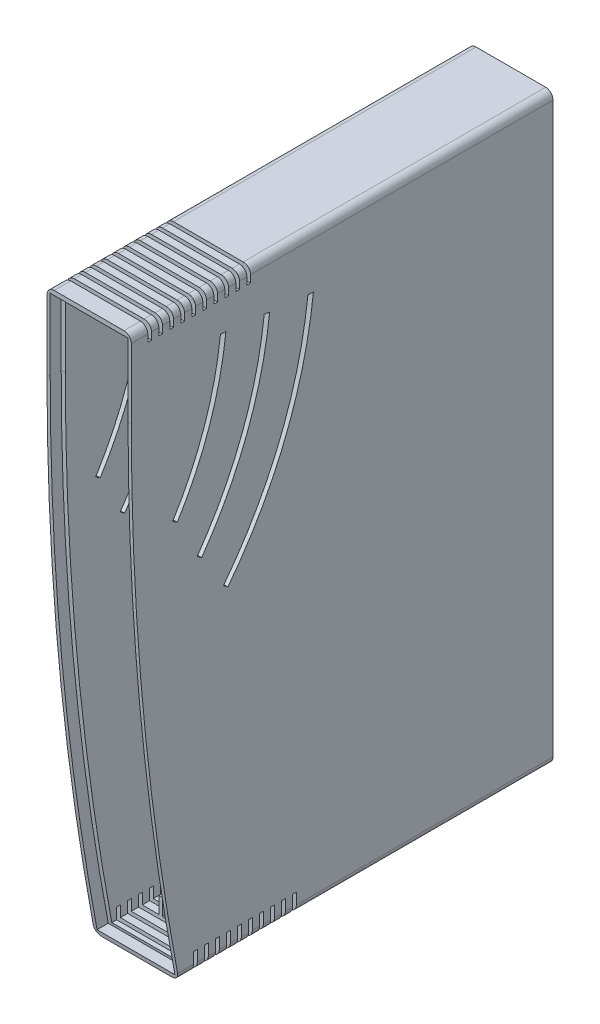
from build123d import *

# Parameters (mm, degrees)
SKETCH1_W               = 23
SKETCH1_H               = 159.1
BOSS_EXTRUDE1_DEPTH     = 115
SHELL1_T                = -2
CUT_EXTRUDE1_DEPTH      = 142.711687944
CUT_EXTRUDE1_DEPTH_BACK = 142.711687944
FILLET1_R               = 2
SKETCH3_W               = 25
SKETCH3_H               = 1
CUT_EXTRUDE2_DEPTH      = 4
LPATTERN1_COUNT         = 10
LPATTERN1_PITCH         = 3
SKETCH8_W               = 27.700077209
SKETCH8_H               = 1
CUT_EXTRUDE4_DEPTH      = 5
LPATTERN2_COUNT         = 10
LPATTERN2_PITCH         = 3
CUT_EXTRUDE3_DEPTH      = 142.711688098
SKETCH7_W               = 1
SKETCH7_H               = 4.5
BOSS_EXTRUDE3_DEPTH     = 90
CHAMFER2_SIZE           = 0.5
CUT_EXTRUDE6_DEPTH      = 10.611
SKETCH11_W              = 1
SKETCH11_H              = 4.5
BOSS_EXTRUDE6_DEPTH     = 89
SKETCH12_W              = 16.3
SKETCH12_H              = 24.5
SKETCH12_W_2            = 17
SKETCH12_H_2            = 14.5
SKETCH12_W_3            = 16.8
SKETCH12_H_3            = 30.2
CUT_EXTRUDE7_DEPTH      = 2


with BuildPart() as part:
    # Sketch1 → Boss-Extrude1 (new body)
    with BuildSketch(Plane.XY):
        Rectangle(SKETCH1_W, SKETCH1_H)
    extrude(amount=BOSS_EXTRUDE1_DEPTH)

    # Shell1
    shell1_openings = [part.faces().sort_by_distance(p)[0] for p in [
        (0, 0, 115),
    ]]
    offset(amount=SHELL1_T, openings=shell1_openings, kind=Kind.INTERSECTION)

    # Sketch2 → Cut-Extrude1 (cut, two sides: drawn at the far end of the back side and taken through both)
    with BuildSketch(Plane(origin=(11.5, 0, 0), x_dir=(0, 0, -1), z_dir=(1, 0, 0)).offset(-CUT_EXTRUDE1_DEPTH_BACK)):
        with BuildLine():
            Line((-115, 482.170987722), (-115, 79.55))
            Line((-115, 79.55), (-115, 58.65))
            ThreePointArc((-115, 58.65), (-111.742842211, -10.755043044), (-102, -79.55))
            Line((-102, -79.55), (-26.918013628, -475.108282781))
            Line((-26.918013628, -475.108282781), (-828.772746701, -548.88921573))
            Line((-828.772746701, -548.88921573), (-916.854733073, 408.390054773))
            Line((-916.854733073, 408.390054773), (-115, 482.170987722))
        make_face()
    extrude(amount=CUT_EXTRUDE1_DEPTH + CUT_EXTRUDE1_DEPTH_BACK, mode=Mode.SUBTRACT)

    # Fillet1
    fillet1_edges = [part.edges().sort_by_distance(p)[0] for p in [
        (11.5, -79.55, 51),
        (-11.5, -79.55, 51),
        (-11.5, 79.55, 57.5),
        (11.5, 79.55, 57.5),
    ]]
    fillet(fillet1_edges, radius=FILLET1_R)

    # Sketch3 → Cut-Extrude2 (cut)
    with BuildSketch(Plane(origin=(0, 79.55, 0), x_dir=(1, 0, 0), z_dir=(0, 1, 0))):
        with Locations((0, -110)):
            Rectangle(SKETCH3_W, SKETCH3_H)
    cut_extrude2 = extrude(amount=-CUT_EXTRUDE2_DEPTH, mode=Mode.SUBTRACT)

    # LPattern1: Cut-Extrude2 ×10
    with Locations(*[(0, 0, -i * LPATTERN1_PITCH) for i in range(1, LPATTERN1_COUNT)]):
        add(cut_extrude2, mode=Mode.SUBTRACT)

    # Sketch8 → Cut-Extrude4 (cut)
    with BuildSketch(Plane.XZ.offset(79.55)):
        with Locations((0.524208986, 97.5)):
            Rectangle(SKETCH8_W, SKETCH8_H)
    cut_extrude4 = extrude(amount=-CUT_EXTRUDE4_DEPTH, mode=Mode.SUBTRACT)

    # LPattern2: Cut-Extrude4 ×10
    with Locations(*[(0, 0, -i * LPATTERN2_PITCH) for i in range(1, LPATTERN2_COUNT)]):
        add(cut_extrude4, mode=Mode.SUBTRACT)

    # Sketch5 → Cut-Extrude3 (cut, through all)
    with BuildSketch(Plane.ZY.offset(11.5)):
        with BuildLine():
            Line((65.347036406, 64.823533738), (66.838155653, 64.986516539))
            ThreePointArc((66.838155653, 64.986516539), (74.40797048, 34.807641847), (89.855449244, 7.799458383))
            Line((89.855449244, 7.799458383), (88.667189124, 6.88401429))
            ThreePointArc((88.667189124, 6.88401429), (73.01645406, 34.24756859), (65.347036406, 64.823533738))
        make_face()
        with BuildLine():
            Line((77.275990376, 66.127396149), (78.767109622, 66.29037895))
            ThreePointArc((78.767109622, 66.29037895), (84.83196797, 41.097147113), (97.049571899, 18.245197712))
            Line((97.049571899, 18.245197712), (95.827312392, 17.375668128))
            ThreePointArc((95.827312392, 17.375668128), (83.430037817, 40.563675608), (77.275990376, 66.127396149))
        make_face()
        with BuildLine():
            Line((89.204944346, 67.431258559), (90.696063592, 67.594241361))
            ThreePointArc((90.696063592, 67.594241361), (95.094328846, 47.99151385), (103.7314578, 29.852835107))
            Line((103.7314578, 29.852835107), (102.457595124, 29.060828868))
            ThreePointArc((102.457595124, 29.060828868), (93.67651402, 47.501818923), (89.204944346, 67.431258559))
        make_face()
    extrude(amount=-CUT_EXTRUDE3_DEPTH, mode=Mode.SUBTRACT)

    # Sketch7 → Boss-Extrude3 (add)
    with BuildSketch(Plane.XY.offset(95)):
        with Locations((-4.5, 75.3)):
            Rectangle(SKETCH7_W, SKETCH7_H)
        with Locations((-1.7, 75.3)):
            Rectangle(SKETCH7_W, SKETCH7_H)
    extrude(amount=-BOSS_EXTRUDE3_DEPTH)

    # Chamfer2
    chamfer2_edges = [part.edges().sort_by_distance(p)[0] for p in [
        (-2.2, 75.3, 95),
        (-4, 75.3, 95),
    ]]
    chamfer(chamfer2_edges, length=CHAMFER2_SIZE)

    # Sketch10 → Cut-Extrude6 (cut, symmetric)
    with BuildSketch(Plane(origin=(0, 0, 0), x_dir=(0, 0, -1), z_dir=(1, 0, 0))):
        with BuildLine():
            Line((-131.709183252, 78.35), (-112, 78.35))
            Line((-112, 78.35), (-112, 58.65))
            ThreePointArc((-112, 58.65), (-108.78648369, -10.149542881), (-99.173917094, -78.35))
            Line((-99.173917094, -78.35), (-102.923842912, -78.35))
            Line((-102.923842912, -78.35), (-131.709183252, 78.35))
        make_face()
    extrude(amount=CUT_EXTRUDE6_DEPTH, both=True, mode=Mode.SUBTRACT)

    # Sketch11 → Boss-Extrude6 (add)
    with BuildSketch(Plane.XY.offset(2)):
        with Locations((-4.5, -75.3)):
            Rectangle(SKETCH11_W, SKETCH11_H)
        with Locations((-1.7, -75.3)):
            Rectangle(SKETCH11_W, SKETCH11_H)
    extrude(amount=BOSS_EXTRUDE6_DEPTH)

    # Sketch12 → Cut-Extrude7 (cut)
    with BuildSketch(Plane(origin=(0, 0, 0), x_dir=(-1, 0, 0), z_dir=(0, 0, -1))):
        with Locations((-1.15, 59.23)):
            Rectangle(SKETCH12_W, SKETCH12_H)
        with Locations((-0.9, -5.8)):
            Rectangle(SKETCH12_W_2, SKETCH12_H_2)
        with Locations((-0.9, -56.37)):
            Rectangle(SKETCH12_W_3, SKETCH12_H_3)
    extrude(amount=-CUT_EXTRUDE7_DEPTH, mode=Mode.SUBTRACT)


solid = part.part
